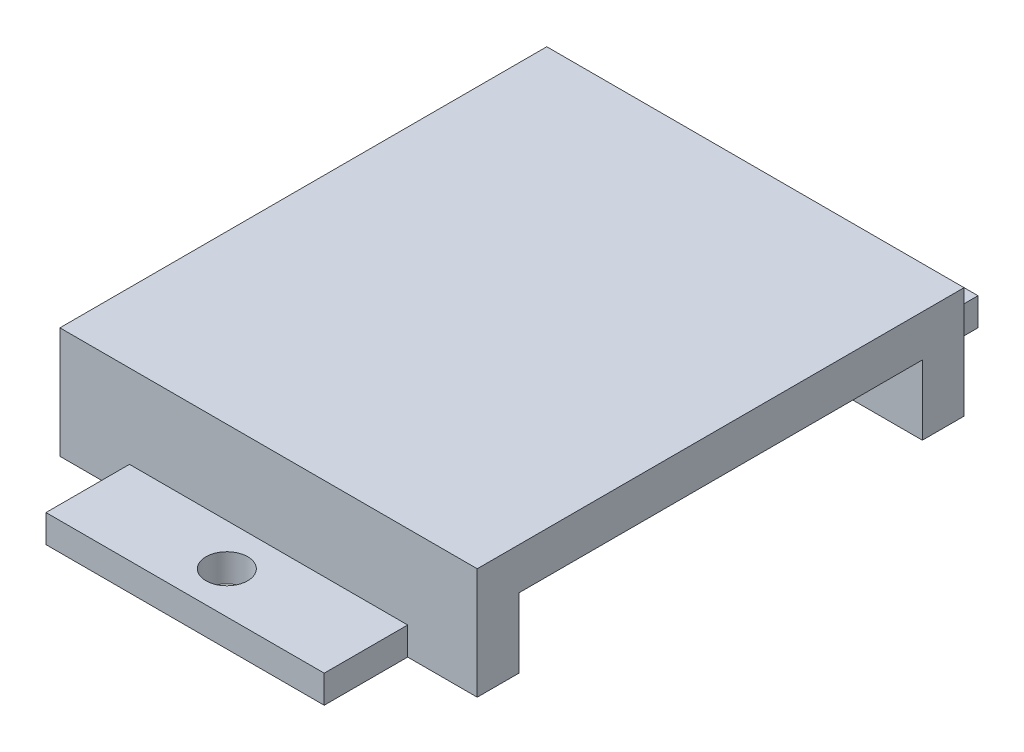
from build123d import *

# Parameters (mm, degrees)
SKETCH1_W                 = 30
SKETCH1_H                 = 35
BOSS_EXTRUDE1_DEPTH       = 8
SKETCH3_W                 = 29
SKETCH3_H                 = 5
CUT_EXTRUDE1_DEPTH        = 68
SKETCH4_W                 = 20
SKETCH4_H                 = 2
BOSS_EXTRUDE2_DEPTH       = 6
SKETCH5_W                 = 20
SKETCH5_H                 = 2
BOSS_EXTRUDE3_DEPTH       = 6
F_3_0MM_DOWEL_HOLE1_D     = 3
F_3_0MM_DOWEL_HOLE1_DEPTH = 12
F_3_0MM_DOWEL_HOLE1_TIP   = 0.901290929


with BuildPart() as part:
    # Sketch1 → Boss-Extrude1 (new body)
    with BuildSketch(Plane(origin=(0, 0, 0), x_dir=(1, 0, 0), z_dir=(0, 1, 0))):
        with Locations((-15, 17.5)):
            Rectangle(SKETCH1_W, SKETCH1_H)
    extrude(amount=BOSS_EXTRUDE1_DEPTH)

    # Sketch3 → Cut-Extrude1 (cut)
    with BuildSketch(Plane(origin=(0, 0, 0), x_dir=(0, 0, -1), z_dir=(1, 0, 0))):
        with Locations((17.5, 2.5)):
            Rectangle(SKETCH3_W, SKETCH3_H)
    extrude(amount=-CUT_EXTRUDE1_DEPTH, mode=Mode.SUBTRACT)

    # Sketch4 → Boss-Extrude2 (add)
    with BuildSketch(Plane.XY):
        with Locations((-15, 1)):
            Rectangle(SKETCH4_W, SKETCH4_H)
    extrude(amount=BOSS_EXTRUDE2_DEPTH)

    # Sketch5 → Boss-Extrude3 (add)
    with BuildSketch(Plane(origin=(0, 0, -35), x_dir=(-1, 0, 0), z_dir=(0, 0, -1))):
        with Locations((15, 1)):
            Rectangle(SKETCH5_W, SKETCH5_H)
    extrude(amount=BOSS_EXTRUDE3_DEPTH)

    # Ø3.0mm Dowel Hole1
    with Locations(Plane.XZ):
        with Locations((-15, -38), (-15, 3)):
            Hole(F_3_0MM_DOWEL_HOLE1_D / 2, depth=F_3_0MM_DOWEL_HOLE1_DEPTH)
            with Locations((0, 0, -(F_3_0MM_DOWEL_HOLE1_DEPTH + F_3_0MM_DOWEL_HOLE1_TIP / 2))):  # 118° drill point
                Cone(0, F_3_0MM_DOWEL_HOLE1_D / 2, F_3_0MM_DOWEL_HOLE1_TIP, mode=Mode.SUBTRACT)


solid = part.part
